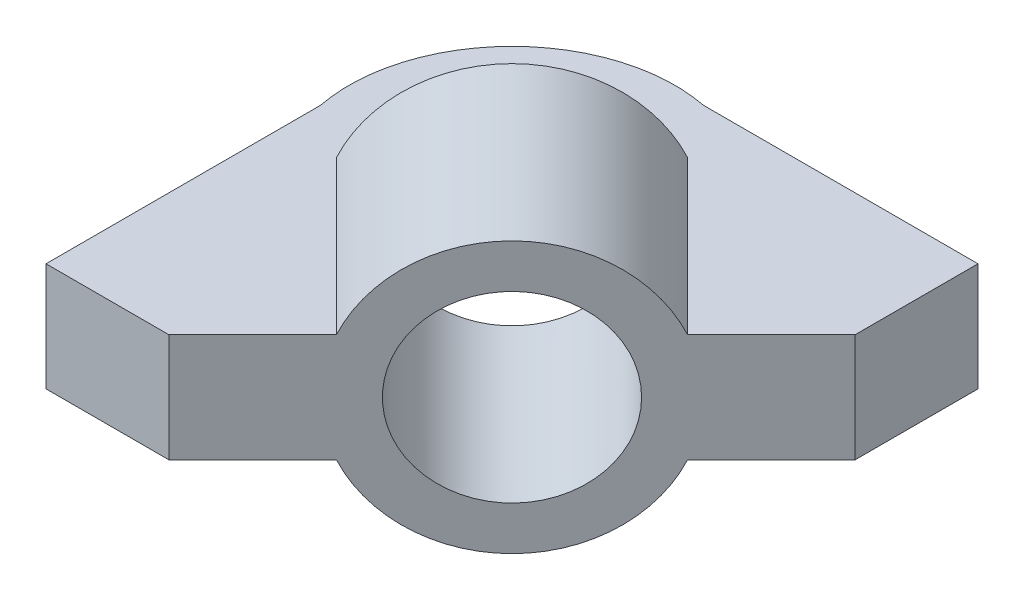
from build123d import *

# Parameters (mm, degrees)
BOSS_EXTRUDE1_DEPTH = 3
SKETCH2_R           = 7.5
SKETCH2_R_2         = 5.075
BOSS_EXTRUDE2_DEPTH = 12.02
SKETCH3_R           = 5.075
CUT_EXTRUDE1_DEPTH  = 12.02
SKETCH4_R           = 1.5
CUT_EXTRUDE2_DEPTH  = 6
SKETCH5_R           = 1.5
CUT_EXTRUDE3_DEPTH  = 3
SKETCH6_R           = 1.5
CUT_EXTRUDE4_DEPTH  = 3


with BuildPart() as part:
    # Sketch1 → Boss-Extrude1 (new, symmetric)
    with BuildSketch(Plane(origin=(0, 0, 0), x_dir=(1, 0, 0), z_dir=(0, 1, 0))):
        with BuildLine():
            Line((20.5, -1.5), (20.5, 0))
            Line((20.5, 0), (20.5, 2.035533906))
            Line((20.5, 2.035533906), (20.5, 3.535533906))
            Line((20.5, 3.535533906), (20.5, 5.303300859))
            Line((20.5, 5.303300859), (5.303300859, 5.303300859))
            ThreePointArc((5.303300859, 5.303300859), (-2.828427125, 2.828427125), (-5.303300859, -5.303300859))
            Line((-5.303300859, -5.303300859), (-5.303300859, -20.5))
            Line((-5.303300859, -20.5), (-3.535533906, -20.5))
            Line((-3.535533906, -20.5), (-2.035533906, -20.5))
            Line((-2.035533906, -20.5), (0, -20.5))
            Line((0, -20.5), (1.5, -20.5))
            Line((1.5, -20.5), (20.5, -1.5))
        make_face()
    extrude(amount=BOSS_EXTRUDE1_DEPTH, both=True)

    # Sketch2 → Boss-Extrude2 (add)
    with BuildSketch(Plane(origin=(11, 0, 11), x_dir=(0.7071067811865475, 0, -0.7071067811865477), z_dir=(0.7071067811865477, 0, 0.7071067811865475))):
        Circle(SKETCH2_R)
        Circle(SKETCH2_R_2, mode=Mode.SUBTRACT)
    extrude(amount=-BOSS_EXTRUDE2_DEPTH)

    # Sketch3 → Cut-Extrude1 (cut)
    with BuildSketch(Plane(origin=(11, 0, 11), x_dir=(0.7071067811865475, 0, -0.7071067811865477), z_dir=(0.7071067811865477, 0, 0.7071067811865475))):
        Circle(SKETCH3_R)
    extrude(amount=-CUT_EXTRUDE1_DEPTH, mode=Mode.SUBTRACT)

    # Sketch4 → Cut-Extrude2 (cut)
    with BuildSketch(Plane(origin=(0, 3, 0), x_dir=(1, 0, 0), z_dir=(0, 1, 0))):
        with Locations(Location((-0.349848925, 0.357263409, 0), (0, 0, 270))):
            Circle(SKETCH4_R)
    extrude(amount=-CUT_EXTRUDE2_DEPTH, mode=Mode.SUBTRACT)

    # Sketch5 → Cut-Extrude3 (cut)
    with BuildSketch(Plane.ZY.offset(5.303300859)):
        with Locations((15, 0)):
            Circle(SKETCH5_R)
    extrude(amount=-CUT_EXTRUDE3_DEPTH, mode=Mode.SUBTRACT)

    # Sketch6 → Cut-Extrude4 (cut)
    with BuildSketch(Plane(origin=(0, 0, -5.303300859), x_dir=(-1, 0, 0), z_dir=(0, 0, -1))):
        with Locations((-15, 0)):
            Circle(SKETCH6_R)
    extrude(amount=-CUT_EXTRUDE4_DEPTH, mode=Mode.SUBTRACT)


solid = part.part
